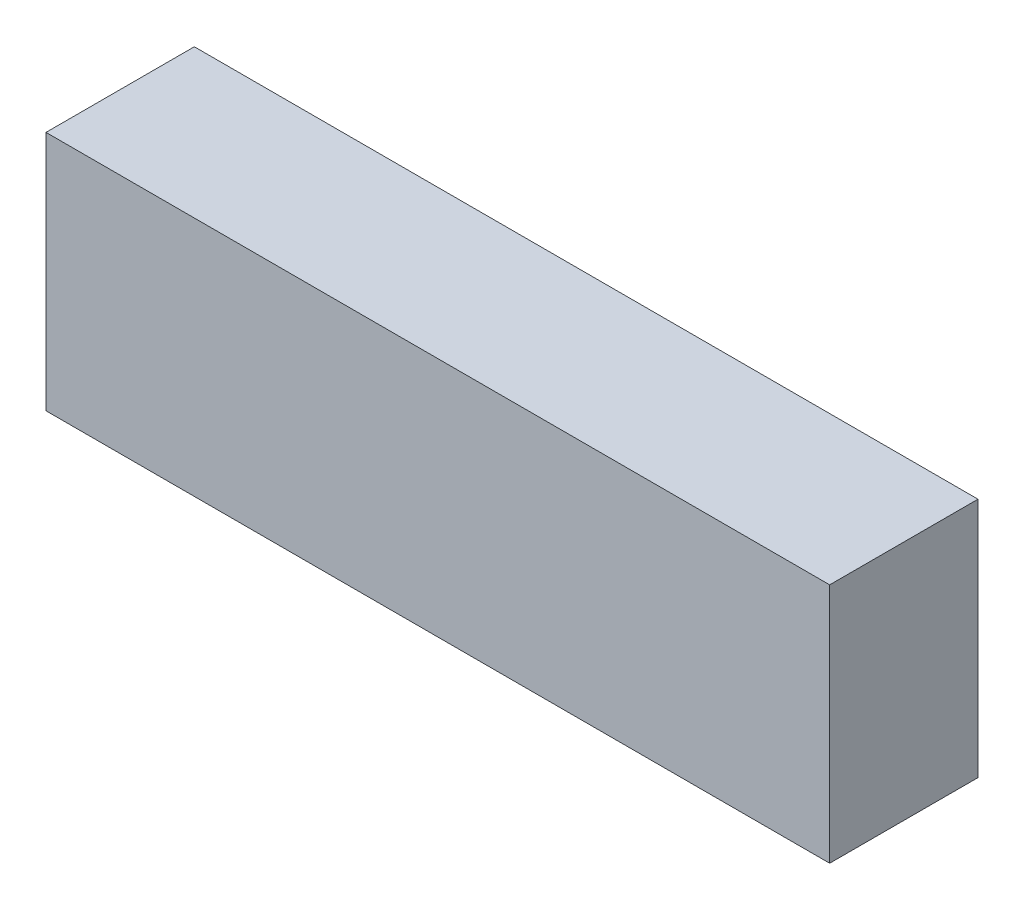
from build123d import *

# Parameters (mm, degrees)
SKETCH1_W               = 5.2832
SKETCH1_H               = 1.6256
COMPONENT_OUTLINE_DEPTH = 1


with BuildPart() as part:
    # Sketch1 → Component_Outline (new body)
    with BuildSketch(Plane.XY):
        with Locations((0, 0.0508)):
            Rectangle(SKETCH1_W, SKETCH1_H)
    extrude(amount=COMPONENT_OUTLINE_DEPTH)


solid = part.part
